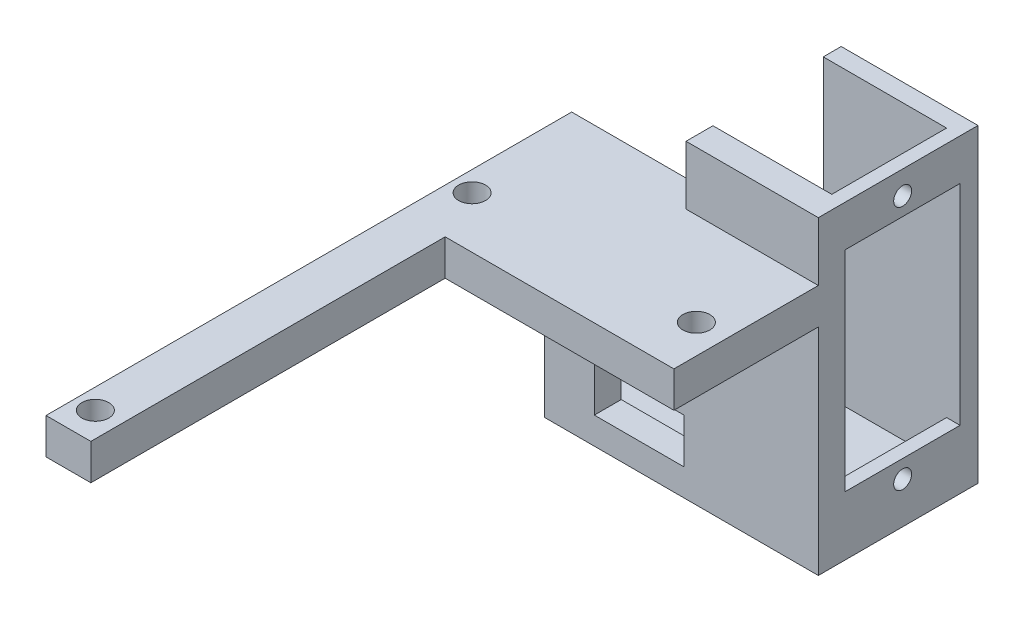
from build123d import *

# Parameters (mm, degrees)
SKETCH1_W            = 25.5
SKETCH1_H            = 14
BOSS_EXTRUDE1_DEPTH  = 4
SKETCH2_R            = 1.5
CUT_EXTRUDE1_DEPTH   = 53.71750714
SKETCH3_W            = 30.5
SKETCH3_H            = 4
BOSS_EXTRUDE2_DEPTH  = 5.1
SKETCH4_W            = 30.5
SKETCH4_H            = 3
BOSS_EXTRUDE3_DEPTH  = 24
SKETCH5_W            = 30.5
SKETCH5_H            = 2
BOSS_EXTRUDE8_DEPTH  = 14.8
SKETCH10_W           = 30.5
SKETCH10_H           = 2
BOSS_EXTRUDE9_DEPTH  = 16.8
SKETCH11_W           = 1.5
SKETCH11_H           = 12.8
BOSS_EXTRUDE10_DEPTH = 4.6
SKETCH13_W           = 15.25
SKETCH13_H           = 2
BOSS_EXTRUDE11_DEPTH = 15.75
SKETCH14_W           = 10
SKETCH14_H           = 5
CUT_EXTRUDE5_DEPTH   = 3
SKETCH16_R           = 1
CUT_EXTRUDE6_DEPTH   = 10
SKETCH15_W           = 14.75
SKETCH15_H           = 3
BOSS_EXTRUDE12_DEPTH = 6.55


with BuildPart() as part:
    # Sketch1 → Boss-Extrude1 (new body)
    with BuildSketch(Plane(origin=(0, 0, 0), x_dir=(1, 0, 0), z_dir=(0, 1, 0))):
        Polygon((-36.234375, 20.8984375), (-41.234375, 20.8984375), (-41.234375, -32.6015625), (-36.234375, -32.6015625), (-36.234375, 6.8984375), align=None)
        with Locations((-23.484375, 13.8984375)):
            Rectangle(SKETCH1_W, SKETCH1_H)
    extrude(amount=BOSS_EXTRUDE1_DEPTH)

    # Sketch2 → Cut-Extrude1 (cut, through all)
    with BuildSketch(Plane(origin=(0, 4, 0), x_dir=(1, 0, 0), z_dir=(0, 1, 0))):
        with Locations(Location((-38.984375, -29.3515625, 0), (0, 0, 270))):
            Circle(SKETCH2_R)
        with Locations(Location((-38.984375, 12.6484375, 0), (0, 0, 270))):
            Circle(SKETCH2_R)
        with Locations(Location((-13.984375, 12.6484375, 0), (0, 0, 270))):
            Circle(SKETCH2_R)
    extrude(amount=-CUT_EXTRUDE1_DEPTH, mode=Mode.SUBTRACT)

    # Sketch3 → Boss-Extrude2 (add)
    with BuildSketch(Plane(origin=(0, 0, -20.8984375), x_dir=(-1, 0, 0), z_dir=(0, 0, -1))):
        with Locations((25.984375, 2)):
            Rectangle(SKETCH3_W, SKETCH3_H)
    extrude(amount=BOSS_EXTRUDE2_DEPTH)

    # Sketch4 → Boss-Extrude3 (add)
    with BuildSketch(Plane.XZ):
        with Locations((-25.984375, -24.4984375)):
            Rectangle(SKETCH4_W, SKETCH4_H)
    extrude(amount=BOSS_EXTRUDE3_DEPTH)

    # Sketch5 → Boss-Extrude8 (add)
    with BuildSketch(Plane(origin=(0, 0, -25.9984375), x_dir=(-1, 0, 0), z_dir=(0, 0, -1))):
        with Locations((25.984375, -23)):
            Rectangle(SKETCH5_W, SKETCH5_H)
    extrude(amount=BOSS_EXTRUDE8_DEPTH)

    # Sketch10 → Boss-Extrude9 (add)
    with BuildSketch(Plane(origin=(0, -22, 0), x_dir=(1, 0, 0), z_dir=(0, 1, 0))):
        with Locations((-25.984375, 39.7984375)):
            Rectangle(SKETCH10_W, SKETCH10_H)
    extrude(amount=BOSS_EXTRUDE9_DEPTH)

    # Sketch11 → Boss-Extrude10 (add)
    with BuildSketch(Plane(origin=(0, -22, 0), x_dir=(1, 0, 0), z_dir=(0, 1, 0))):
        with Locations((-11.484375, 32.3984375)):
            Rectangle(SKETCH11_W, SKETCH11_H)
    boss_extrude10 = extrude(amount=BOSS_EXTRUDE10_DEPTH)

    # Sketch13 → Boss-Extrude11 (add)
    with BuildSketch(Plane(origin=(0, -5.2, 0), x_dir=(1, 0, 0), z_dir=(0, 1, 0))):
        with Locations((-18.359375, 39.7984375)):
            Rectangle(SKETCH13_W, SKETCH13_H)
    extrude(amount=BOSS_EXTRUDE11_DEPTH)

    # Sketch14 → Cut-Extrude5 (cut)
    with BuildSketch(Plane.XY.offset(-22.9984375)):
        with Locations((-30.706752917, -18.5)):
            Rectangle(SKETCH14_W, SKETCH14_H)
    extrude(amount=-CUT_EXTRUDE5_DEPTH, mode=Mode.SUBTRACT)

    # Sketch16 → Cut-Extrude6 (cut)
    with BuildSketch(Plane(origin=(-10.734375, 0, 0), x_dir=(0, 0, -1), z_dir=(1, 0, 0))):
        with Locations((32.3984375, -19.4)):
            Circle(SKETCH16_R)
    cut_extrude6 = extrude(amount=-CUT_EXTRUDE6_DEPTH, mode=Mode.SUBTRACT)

    # Mirror1: Boss-Extrude10, Cut-Extrude6 across plane
    add(boss_extrude10.mirror(Plane(origin=(0, -5.725, 0), x_dir=(0, 0, 1), z_dir=(0, -1, 0))))
    add(cut_extrude6.mirror(Plane(origin=(0, -5.725, 0), x_dir=(0, 0, 1), z_dir=(0, -1, 0))), mode=Mode.SUBTRACT)

    # Sketch15 → Boss-Extrude12 (add)
    with BuildSketch(Plane(origin=(0, 4, 0), x_dir=(1, 0, 0), z_dir=(0, 1, 0))):
        with Locations((-18.109375, 24.4984375)):
            Rectangle(SKETCH15_W, SKETCH15_H)
    extrude(amount=BOSS_EXTRUDE12_DEPTH)


solid = part.part
